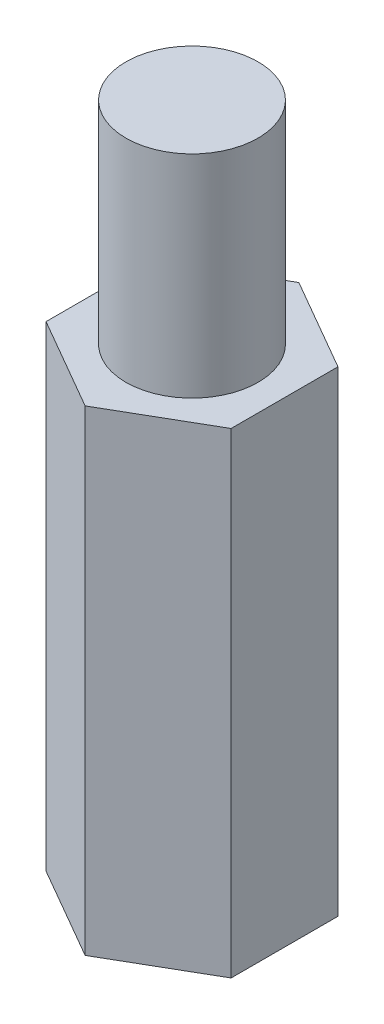
from build123d import *

# Parameters (mm, degrees)
EXTRUDE_1_DEPTH      = 30
EXTRUDE_1_DEPTH_BACK = 0.0001
SKETCH_3_R           = 2.5
CUT_EXTRUDE_1_DEPTH  = 20
SKETCH_4_R           = 2.5
EXTRUDE_2_DEPTH      = 8
SKETCH_5_R           = 7.900729049
CUT_EXTRUDE_2_DEPTH  = 2
SKETCH_6_R           = 13.970712395
CUT_EXTRUDE_3_DEPTH  = 10


with BuildPart() as part:
    # 草图2 → 凸台-拉伸1 (new, two sides: drawn at the far end of the back side and taken through both)
    with BuildSketch(Plane(origin=(0, 0, 0), x_dir=(1, 0, 0), z_dir=(0, 1, 0)).offset(-EXTRUDE_1_DEPTH_BACK)):
        Polygon((0, -4.041451884), (3.5, -2.020725942), (3.5, 2.020725942), (0, 4.041451884), (-3.5, 2.020725942), (-3.5, -2.020725942), align=None)
    extrude(amount=EXTRUDE_1_DEPTH + EXTRUDE_1_DEPTH_BACK)

    # 草图3 → 切除-拉伸1 (cut)
    with BuildSketch(Plane.XZ.offset(0.0001)):
        with Locations(Location((0, 0, 0), (0, 0, 270))):
            Circle(SKETCH_3_R)
    extrude(amount=-CUT_EXTRUDE_1_DEPTH, mode=Mode.SUBTRACT)

    # 草图4 → 凸台-拉伸2 (add)
    with BuildSketch(Plane(origin=(0, 30, 0), x_dir=(1, 0, 0), z_dir=(0, 1, 0))):
        with Locations(Location((0, 0, 0), (0, 0, 90))):
            Circle(SKETCH_4_R)
    extrude(amount=EXTRUDE_2_DEPTH)

    # 草图5 → 切除-拉伸2 (cut)
    with BuildSketch(Plane.XZ.offset(0.0001)):
        Circle(SKETCH_5_R)
    extrude(amount=-CUT_EXTRUDE_2_DEPTH, mode=Mode.SUBTRACT)

    # 草图6 → 切除-拉伸3 (cut)
    with BuildSketch(Plane.XZ.offset(-1.9999)):
        with Locations((-3.086044331, 4.465263264)):
            Circle(SKETCH_6_R)
    extrude(amount=-CUT_EXTRUDE_3_DEPTH, mode=Mode.SUBTRACT)


solid = part.part
